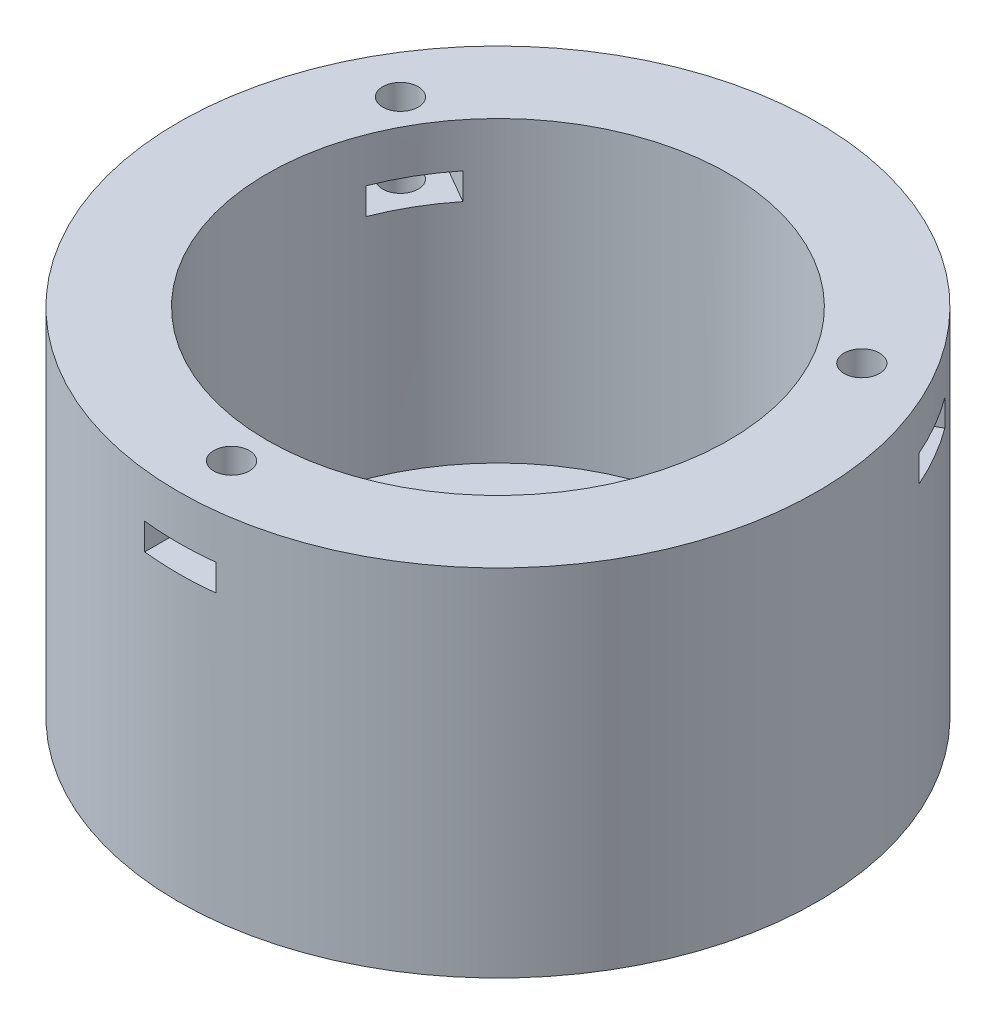
from build123d import *

# Parameters (mm, degrees)
SKETCH1_R                       = 57.15
BOSS_EXTRUDE1_DEPTH             = 63.5
SKETCH2_R                       = 41.275
CUT_EXTRUDE1_DEPTH              = 53.34
F_1_4_0_25_DIAMETER_HOLE4_D     = 6.35
F_1_4_0_25_DIAMETER_HOLE4_DEPTH = 25.4
F_1_4_0_25_DIAMETER_HOLE4_TIP   = 1.907732465
SKETCH7_R                       = 3.81
CUT_EXTRUDE2_DEPTH              = 103.783729257
F_4_0MM_DOWEL_HOLE1_D           = 4
SKETCH9_W                       = 7
SKETCH9_H                       = 7
CUT_EXTRUDE3_DEPTH              = 3.5
SKETCH12_W                      = 12.7
SKETCH12_H                      = 19.05
CUT_EXTRUDE4_DEPTH              = 4.7625


with BuildPart() as part:
    # Sketch1 → Boss-Extrude1 (new body)
    with BuildSketch(Plane(origin=(0, 0, 0), x_dir=(1, 0, 0), z_dir=(0, 1, 0))):
        with Locations(Location((0, 0, 0), (0, 0, 270))):
            Circle(SKETCH1_R)
    extrude(amount=BOSS_EXTRUDE1_DEPTH)

    # Sketch2 → Cut-Extrude1 (cut)
    with BuildSketch(Plane(origin=(0, 63.5, 0), x_dir=(1, 0, 0), z_dir=(0, 1, 0))):
        with Locations(Location((0, 0, 0), (0, 0, 270))):
            Circle(SKETCH2_R)
    extrude(amount=-CUT_EXTRUDE1_DEPTH, mode=Mode.SUBTRACT)

    # 1/4 (0.25) Diameter Hole4
    with Locations(Plane(origin=(0, 63.5, 0), x_dir=(1, 0, 0), z_dir=(0, 1, 0))):
        with Locations((-41.244459855, 23.8125), (0, -47.625), (41.244459855, 23.8125)):
            Hole(F_1_4_0_25_DIAMETER_HOLE4_D / 2, depth=F_1_4_0_25_DIAMETER_HOLE4_DEPTH)
            with Locations((0, 0, -(F_1_4_0_25_DIAMETER_HOLE4_DEPTH + F_1_4_0_25_DIAMETER_HOLE4_TIP / 2))):  # 118° drill point
                Cone(0, F_1_4_0_25_DIAMETER_HOLE4_D / 2, F_1_4_0_25_DIAMETER_HOLE4_TIP, mode=Mode.SUBTRACT)

    # Sketch7 → Cut-Extrude2 (cut, through all)
    with BuildSketch(Plane.XY):
        with Locations((0, 15.24)):
            Circle(SKETCH7_R)
    extrude(amount=-CUT_EXTRUDE2_DEPTH, mode=Mode.SUBTRACT)

    # Ø4.0mm Dowel Hole1 (through all)
    with Locations(Plane(origin=(-5, 0, 15.938504039), x_dir=(0, 0, -1), z_dir=(0, -1, 0))):
        with Locations((0, 0), (0, 10), (49.5, 10), (49.5, 0)):
            Hole(F_4_0MM_DOWEL_HOLE1_D / 2)

    # Sketch9 → Cut-Extrude3 (cut)
    with BuildSketch(Plane.XZ):
        with Locations((-5, 15.938504039)):
            Rectangle(SKETCH9_W, SKETCH9_H)
        with Locations((5, 15.938504039)):
            Rectangle(SKETCH9_W, SKETCH9_H)
        with Locations((5, -33.561495961)):
            Rectangle(SKETCH9_W, SKETCH9_H)
        with Locations((-5, -33.561495961)):
            Rectangle(SKETCH9_W, SKETCH9_H)
    extrude(amount=-CUT_EXTRUDE3_DEPTH, mode=Mode.SUBTRACT)

    # Sketch12 → Cut-Extrude4 (cut)
    with BuildSketch(Plane(origin=(0, 50.8, 0), x_dir=(1, 0, 0), z_dir=(0, 1, 0))):
        Polygon((-54.992429237, 24.417545405), (-38.494645295, 14.892545405), (-35.319645295, 20.391806719), (-51.817429237, 29.916806719), align=None)
        Polygon((-51.817429237, 29.916806719), (-35.319645295, 20.391806719), (-32.144645295, 25.891068033), (-48.642429237, 35.416068033), align=None)
        Polygon((32.144645295, 25.891068033), (35.319645295, 20.391806719), (51.817429237, 29.916806719), (48.642429237, 35.416068033), align=None)
        Polygon((51.817429237, 29.916806719), (35.319645295, 20.391806719), (38.494645295, 14.892545405), (54.992429237, 24.417545405), align=None)
        with Locations((0, -50.308613437)):
            Rectangle(SKETCH12_W, SKETCH12_H)
    extrude(amount=CUT_EXTRUDE4_DEPTH, mode=Mode.SUBTRACT)


solid = part.part
